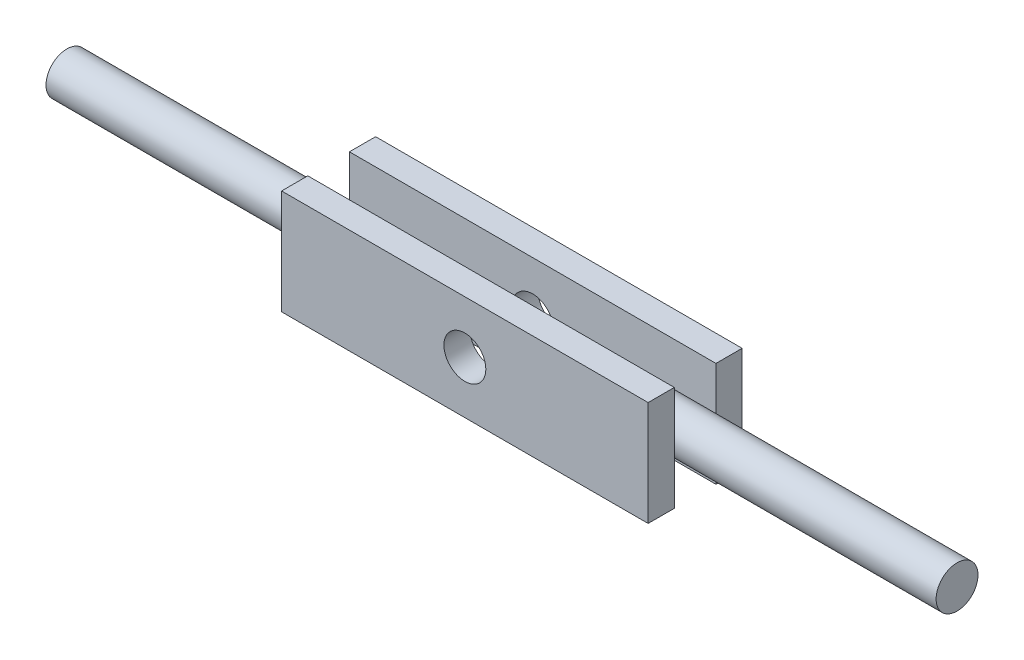
from build123d import *

# Parameters (mm, degrees)
SKETCH1_W                = 140
SKETCH1_H                = 40
BOSS_EXTRUDE1_DEPTH      = 10
SKETCH4_R                = 8
CUT_EXTRUDE1_DEPTH       = 10
BOSS_EXTRUDE2_DEPTH      = 100
BOSS_EXTRUDE2_DEPTH_BACK = 20
SKETCH5_R                = 8
LPATTERN1_COUNT          = 2
LPATTERN1_PITCH          = 25.9
CUT_EXTRUDE2_START       = -100
SKETCH6_R                = 8
CUT_EXTRUDE2_DEPTH       = 100
BOSS_EXTRUDE3_DEPTH      = 100
BOSS_EXTRUDE3_DEPTH_BACK = 20
SKETCH7_R                = 8


with BuildPart() as part:
    # Sketch1 → Boss-Extrude1 (new body)
    with BuildSketch(Plane.XY):
        Rectangle(SKETCH1_W, SKETCH1_H)
    boss_extrude1 = extrude(amount=BOSS_EXTRUDE1_DEPTH)

    # Sketch4 → Cut-Extrude1 (cut)
    with BuildSketch(Plane.XY.offset(10)):
        Circle(SKETCH4_R)
    extrude(amount=-CUT_EXTRUDE1_DEPTH, mode=Mode.SUBTRACT)


with BuildPart() as body_2:
    # Sketch5 → Boss-Extrude2 (new, two sides: drawn at the far end of the back side and taken through both)
    with BuildSketch(Plane(origin=(70, 0, 0), x_dir=(0, 0, -1), z_dir=(1, 0, 0)).offset(-BOSS_EXTRUDE2_DEPTH_BACK)):
        with Locations((8, 0)):
            Circle(SKETCH5_R)
    extrude(amount=BOSS_EXTRUDE2_DEPTH + BOSS_EXTRUDE2_DEPTH_BACK)

    # LPattern1: Boss-Extrude1 ×2
    with Locations(*[(0, 0, -i * LPATTERN1_PITCH) for i in range(1, LPATTERN1_COUNT)]):
        add(boss_extrude1)

    # Sketch6 → Cut-Extrude2 (cut)
    with BuildSketch(Plane(origin=(0, 0, -25.9), x_dir=(-1, 0, 0), z_dir=(0, 0, -1)).offset(CUT_EXTRUDE2_START)):
        Circle(SKETCH6_R)
    extrude(amount=CUT_EXTRUDE2_DEPTH, mode=Mode.SUBTRACT)


with BuildPart() as body_3:
    # Sketch7 → Boss-Extrude3 (new, two sides: drawn at the far end of the back side and taken through both)
    with BuildSketch(Plane.ZY.offset(70).offset(-BOSS_EXTRUDE3_DEPTH_BACK)):
        with Locations((-8, 0)):
            Circle(SKETCH7_R)
    extrude(amount=BOSS_EXTRUDE3_DEPTH + BOSS_EXTRUDE3_DEPTH_BACK)


solid = Compound([part.part, body_2.part, body_3.part])
